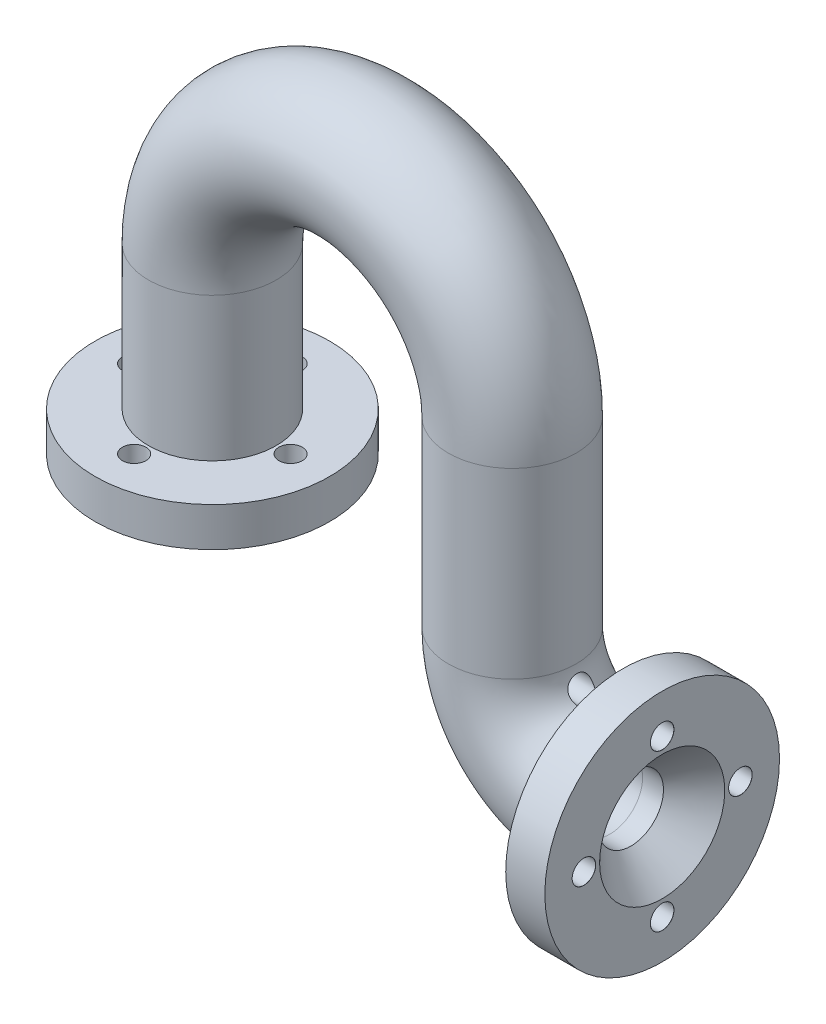
from build123d import *

# Parameters (mm, degrees)
SKETCH2_R           = 24.5
SKETCH2_R_2         = 12.5
BOSS_EXTRUDE1_START = 15
SKETCH3_R           = 45
SKETCH3_R_2         = 12.5
BOSS_EXTRUDE1_DEPTH = 15
BOSS_EXTRUDE2_START = -15
SKETCH4_R           = 45
SKETCH4_R_2         = 12.5
BOSS_EXTRUDE2_DEPTH = 15
CIRPATTERN1_COUNT   = 4
CIRPATTERN2_COUNT   = 4


with BuildPart() as part:
    # Sweep1: sweep along a path in Sketch1
    with BuildLine(Plane.XY) as sweep1_path:
        Line((0, 0), (0, 70))
        ThreePointArc((0, 70), (57.5, 127.5), (115, 70))
        Line((115, 70), (115, 0))
        ThreePointArc((115, 0), (125.983495706, -26.516504294), (152.5, -37.5))
        Line((152.5, -37.5), (157.5, -37.5))
    # Sketch2 → Sweep1 (sweep)
    with BuildSketch(Plane(origin=(0, 0, 0), x_dir=(1, 0, 0), z_dir=(0, 1, 0))):
        Circle(SKETCH2_R)
        Circle(SKETCH2_R_2, mode=Mode.SUBTRACT)
    sweep(path=sweep1_path.line)

    # Sketch3 → Boss-Extrude1 (add)
    with BuildSketch(Plane(origin=(157.5, 0, 0), x_dir=(0, 0, -1), z_dir=(1, 0, 0)).offset(BOSS_EXTRUDE1_START)):
        with Locations((0, -37.5)):
            Circle(SKETCH3_R)
        with Locations((0, -37.5)):
            Circle(SKETCH3_R_2, mode=Mode.SUBTRACT)
    extrude(amount=-BOSS_EXTRUDE1_DEPTH)

    # Sketch4 → Boss-Extrude2 (add)
    with BuildSketch(Plane(origin=(0, 0, 0), x_dir=(-1, 0, 0), z_dir=(0, -1, 0)).offset(BOSS_EXTRUDE2_START)):
        with Locations(Location((0, 0, 0), (0, 0, 90))):
            Circle(SKETCH4_R)
        with Locations(Location((0, 0, 0), (0, 0, 270))):
            Circle(SKETCH4_R_2, mode=Mode.SUBTRACT)
    extrude(amount=BOSS_EXTRUDE2_DEPTH)

    # Sketch10 → Tap Drill for M10x1.0 Tap1 (revolve, cut)
    with BuildSketch(Plane(origin=(-30, 0, 0), x_dir=(0, 0, -1), z_dir=(1, 0, 0))):
        Polygon((0, 0), (0, 72.703872786), (4.5, 70), (4.5, 0.025), (4.525, 0), align=None)
    tap_drill_for_m10x1_0_tap1 = revolve(axis=Axis((-30, -6.35, 0), (0, 1, 0)), mode=Mode.SUBTRACT)

    # CirPattern1: Tap Drill for M10x1.0 Tap1 ×4 about axis
    cirpattern1_axis = Axis((0, 0, 0), (0, 1, 0))
    for i in range(1, CIRPATTERN1_COUNT):
        add(tap_drill_for_m10x1_0_tap1.rotate(cirpattern1_axis, i * 360 / CIRPATTERN1_COUNT), mode=Mode.SUBTRACT)

    # Sketch12 → Tap Drill for M10x1.0 Tap2 (revolve, cut)
    with BuildSketch(Plane(origin=(172.5, -37.5, -30), x_dir=(0, 0, -1), z_dir=(0, 1, 0))):
        Polygon((0, 0), (0, 72.703872786), (4.5, 70), (4.5, 0.025), (4.525, 0), align=None)
    tap_drill_for_m10x1_0_tap2 = revolve(axis=Axis((178.85, -37.5, -30), (-1, 0, 0)), mode=Mode.SUBTRACT)

    # CirPattern2: Tap Drill for M10x1.0 Tap2 ×4 about axis
    cirpattern2_axis = Axis((0, -37.5, 0), (1, 0, 0))
    for i in range(1, CIRPATTERN2_COUNT):
        add(tap_drill_for_m10x1_0_tap2.rotate(cirpattern2_axis, i * 360 / CIRPATTERN2_COUNT), mode=Mode.SUBTRACT)

    # Sketch15 → Cut-Revolve1 (revolve, cut)
    with BuildSketch(Plane.XY, mode=Mode.PRIVATE) as cut_revolve1_sk:
        Polygon((160.5, -37.5), (160.5, -25), (172.5, -13.5), (172.5, -37.5), align=None)
    revolve(cut_revolve1_sk.sketch.rotate(Axis((157.5, -37.5, 0), (1, 0, 0)), 90), axis=Axis((157.5, -37.5, 0), (1, 0, 0)), mode=Mode.SUBTRACT)

    # Sketch16 → Cut-Revolve2 (revolve, cut)
    with BuildSketch(Plane(origin=(0, 0, 0), x_dir=(0, 0, -1), z_dir=(1, 0, 0)), mode=Mode.PRIVATE) as cut_revolve2_sk:
        Polygon((0, 0), (0, 12), (-12.5, 12), (-24, 0), align=None)
    revolve(cut_revolve2_sk.sketch.rotate(Axis((0, 0, 0), (0, 1, 0)), 270), axis=Axis((0, 0, 0), (0, 1, 0)), mode=Mode.SUBTRACT)


solid = part.part
